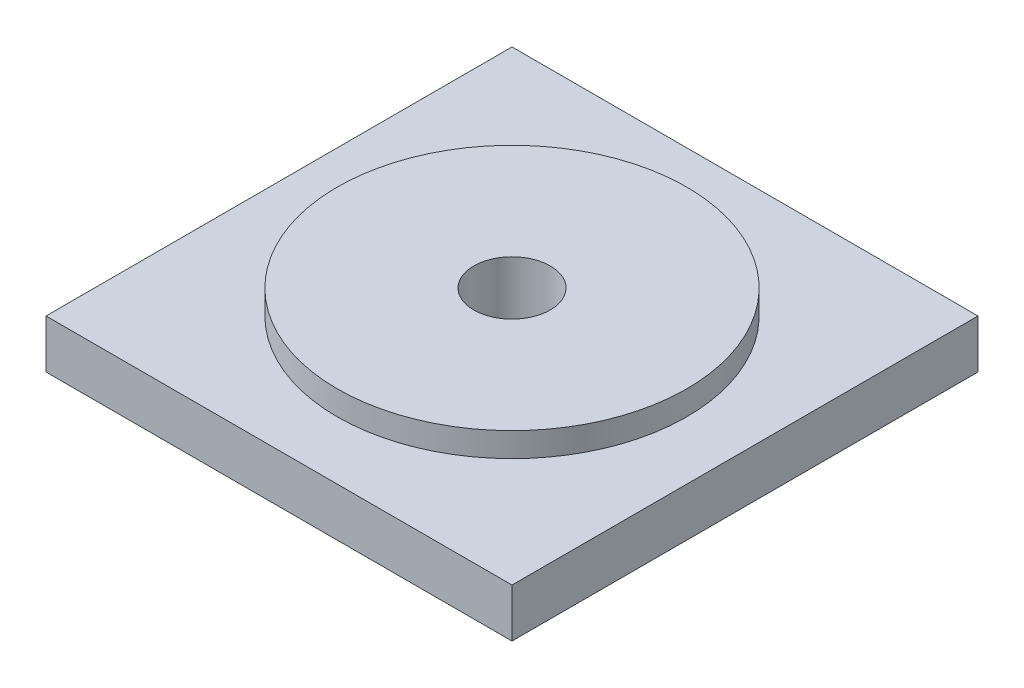
from build123d import *

# Parameters (mm, degrees)
SKETCH1_W           = 24.384
SKETCH1_H           = 24.384
BOSS_EXTRUDE1_DEPTH = 2.54
SKETCH2_R           = 9.144
BOSS_EXTRUDE2_DEPTH = 1.27
SKETCH3_R           = 2
CUT_EXTRUDE1_DEPTH  = 35.694019831


with BuildPart() as part:
    # Sketch1 → Boss-Extrude1 (new body)
    with BuildSketch(Plane(origin=(0, 0, 0), x_dir=(1, 0, 0), z_dir=(0, 1, 0))):
        with Locations((12.192, -12.192)):
            Rectangle(SKETCH1_W, SKETCH1_H)
    extrude(amount=BOSS_EXTRUDE1_DEPTH)

    # Sketch2 → Boss-Extrude2 (add)
    with BuildSketch(Plane(origin=(0, 2.54, 0), x_dir=(1, 0, 0), z_dir=(0, 1, 0))):
        with Locations(Location((12.192, -12.192, 0), (0, 0, 270))):
            Circle(SKETCH2_R)
    extrude(amount=BOSS_EXTRUDE2_DEPTH)

    # Sketch3 → Cut-Extrude1 (cut, through all)
    with BuildSketch(Plane(origin=(0, 3.81, 0), x_dir=(1, 0, 0), z_dir=(0, 1, 0))):
        with Locations(Location((12.192, -12.192, 0), (0, 0, 270))):
            Circle(SKETCH3_R)
    extrude(amount=-CUT_EXTRUDE1_DEPTH, mode=Mode.SUBTRACT)


solid = part.part
